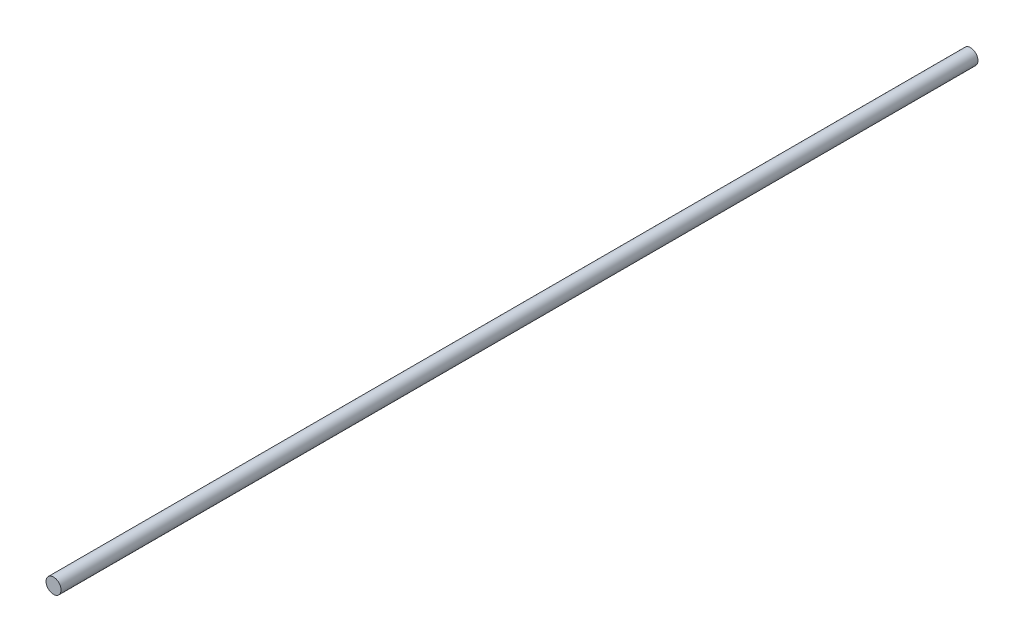
from build123d import *

# Parameters (mm, degrees)
SKETCH1_R           = 10
BOSS_EXTRUDE1_DEPTH = 1219.2


with BuildPart() as part:
    # Sketch1 → Boss-Extrude1 (new body)
    with BuildSketch(Plane.XY):
        with Locations(Location((0, 0, 0), (0, 0, 180))):
            Circle(SKETCH1_R)
    extrude(amount=BOSS_EXTRUDE1_DEPTH)


solid = part.part
